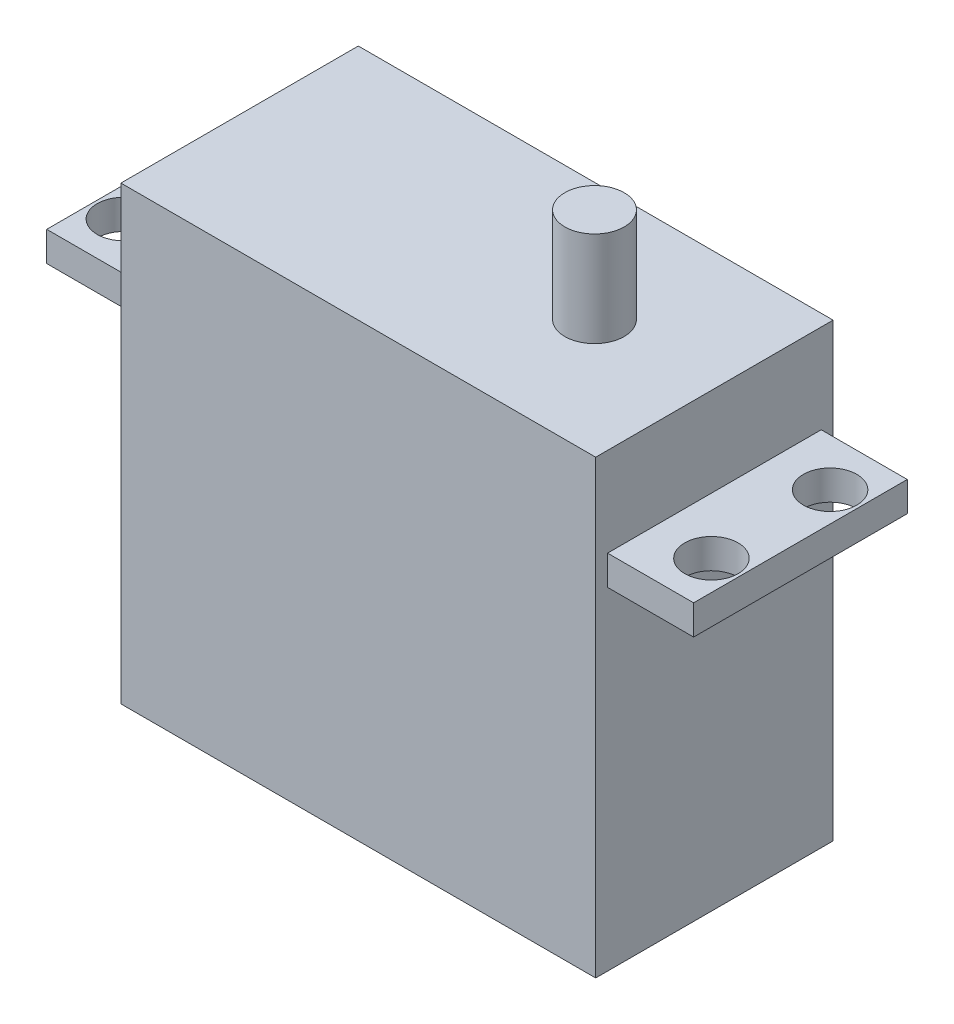
from build123d import *

# Parameters (mm, degrees)
BOSS_EXTRUDE1_DEPTH      = 10
BOSS_EXTRUDE1_DEPTH_BACK = 28
SKETCH1_W                = 40
SKETCH1_H                = 20
SKETCH2_R                = 2.5
BOSS_EXTRUDE2_DEPTH      = 8
SKETCH3_W                = 7.25
SKETCH3_H                = 18
BOSS_EXTRUDE3_DEPTH      = 2.5
SKETCH4_R                = 2.25
CUT_EXTRUDE1_DEPTH       = 44.866388044


with BuildPart() as part:
    # Sketch1 → Boss-Extrude1 (new, two sides: drawn at the far end of the back side and taken through both)
    with BuildSketch(Plane(origin=(0, 0, 0), x_dir=(1, 0, 0), z_dir=(0, 1, 0)).offset(-BOSS_EXTRUDE1_DEPTH_BACK)):
        with Locations((-9.9, 0)):
            Rectangle(SKETCH1_W, SKETCH1_H)
    extrude(amount=BOSS_EXTRUDE1_DEPTH + BOSS_EXTRUDE1_DEPTH_BACK)

    # Sketch2 → Boss-Extrude2 (add)
    with BuildSketch(Plane(origin=(0, 10, 0), x_dir=(1, 0, 0), z_dir=(0, 1, 0))):
        with Locations(Location((0, 0, 0), (0, 0, 270))):
            Circle(SKETCH2_R)
    extrude(amount=BOSS_EXTRUDE2_DEPTH)

    # Sketch3 → Boss-Extrude3 (add)
    with BuildSketch(Plane(origin=(0, 0, 0), x_dir=(1, 0, 0), z_dir=(0, 1, 0))):
        with Locations((13.725, 0)):
            Rectangle(SKETCH3_W, SKETCH3_H)
    boss_extrude3 = extrude(amount=BOSS_EXTRUDE3_DEPTH)

    # Sketch4 → Cut-Extrude1 (cut, symmetric)
    with BuildSketch(Plane(origin=(0, 2.5, 0), x_dir=(1, 0, 0), z_dir=(0, 1, 0))):
        with Locations(Location((14.85, -5, 0), (0, 0, 270))):
            Circle(SKETCH4_R)
        with Locations(Location((14.85, 5, 0), (0, 0, 270))):
            Circle(SKETCH4_R)
    cut_extrude1 = extrude(amount=CUT_EXTRUDE1_DEPTH, both=True, mode=Mode.SUBTRACT)

    # Mirror1: Boss-Extrude3, Cut-Extrude1 across plane
    add(boss_extrude3.mirror(Plane.ZY.offset(9.9)))
    add(cut_extrude1.mirror(Plane.ZY.offset(9.9)), mode=Mode.SUBTRACT)


solid = part.part
